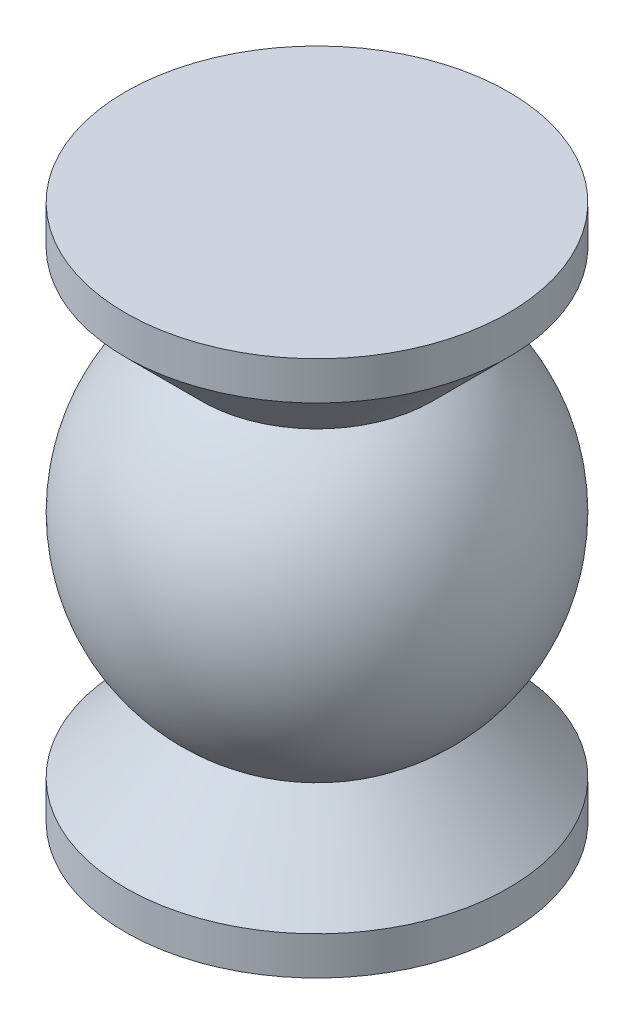
from build123d import *


with BuildPart() as part:
    # 草图1 → 旋转2 (revolve)
    with BuildSketch(Plane.XY):
        with BuildLine():
            Line((0, 20), (0, -20))
            Line((0, -20), (15, -20))
            ThreePointArc((15, -20), (25, 0), (15, 20))
            Line((15, 20), (0, 20))
        make_face()
    revolve(axis=Axis((0, 20, 0), (0, -1, 0)))

    # 草图2 → 旋转3 (revolve)
    with BuildSketch(Plane.XY, mode=Mode.PRIVATE) as revolve_3_sk:
        Polygon((0, 20), (15, 20), (25, 30), (25, 35), (0, 35), align=None)
    revolve_3 = revolve(revolve_3_sk.sketch.rotate(Axis((0, 35, 0), (0, -1, 0)), 180), axis=Axis((0, 35, 0), (0, -1, 0)))

    # 镜向1: 旋转3 across plane
    add(revolve_3.mirror(Plane.ZX))


solid = part.part
